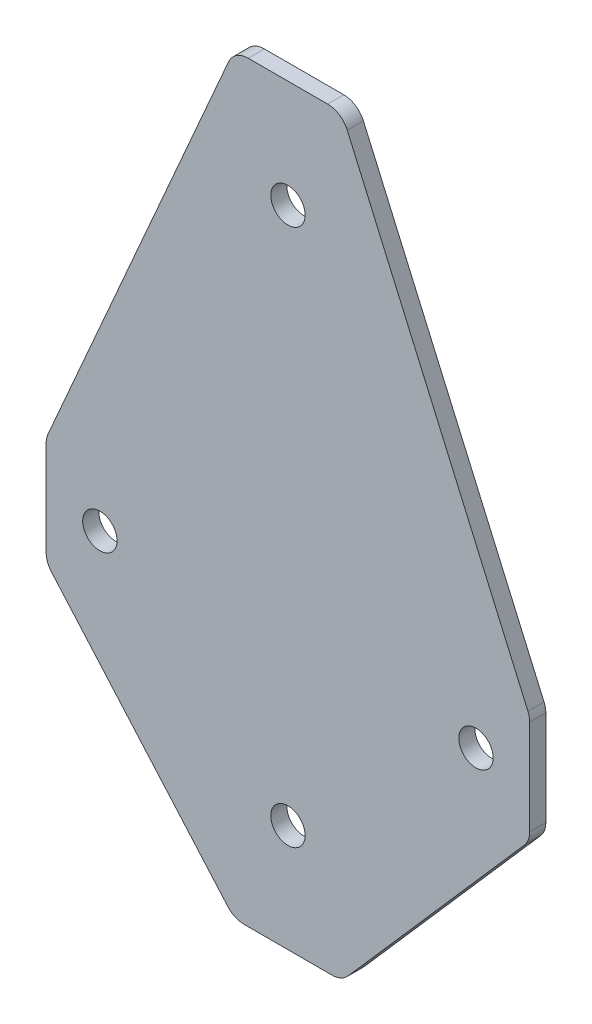
from build123d import *

# Parameters (mm, degrees)
SKETCH_1_R      = 1.6
EXTRUDE_1_DEPTH = 1.5
FILLET_1_R      = 2


with BuildPart() as part:
    # ｽｹｯﾁ1 → ﾎﾞｽ - 押し出し1 (new body)
    with BuildSketch(Plane.XY):
        Polygon((-5, 60), (-22.5, 20), (-22.5, 10), (-5, -10), (5, -10), (22.5, 10), (22.5, 20), (5, 60), align=None)
        Circle(SKETCH_1_R, mode=Mode.SUBTRACT)
        with Locations((0, 50)):
            Circle(SKETCH_1_R, mode=Mode.SUBTRACT)
        with Locations((-17.5, 15)):
            Circle(SKETCH_1_R, mode=Mode.SUBTRACT)
        with Locations((17.5, 15)):
            Circle(SKETCH_1_R, mode=Mode.SUBTRACT)
    extrude(amount=EXTRUDE_1_DEPTH)

    # ﾌｨﾚｯﾄ1
    fillet_1_edges = [part.edges().sort_by_distance(p)[0] for p in [
        (22.5, 20, 0.75),
        (22.5, 10, 0.75),
        (5, -10, 0.75),
        (-5, -10, 0.75),
        (-22.5, 10, 0.75),
        (-22.5, 20, 0.75),
        (-5, 60, 0.75),
        (5, 60, 0.75),
    ]]
    fillet(fillet_1_edges, radius=FILLET_1_R)


solid = part.part
